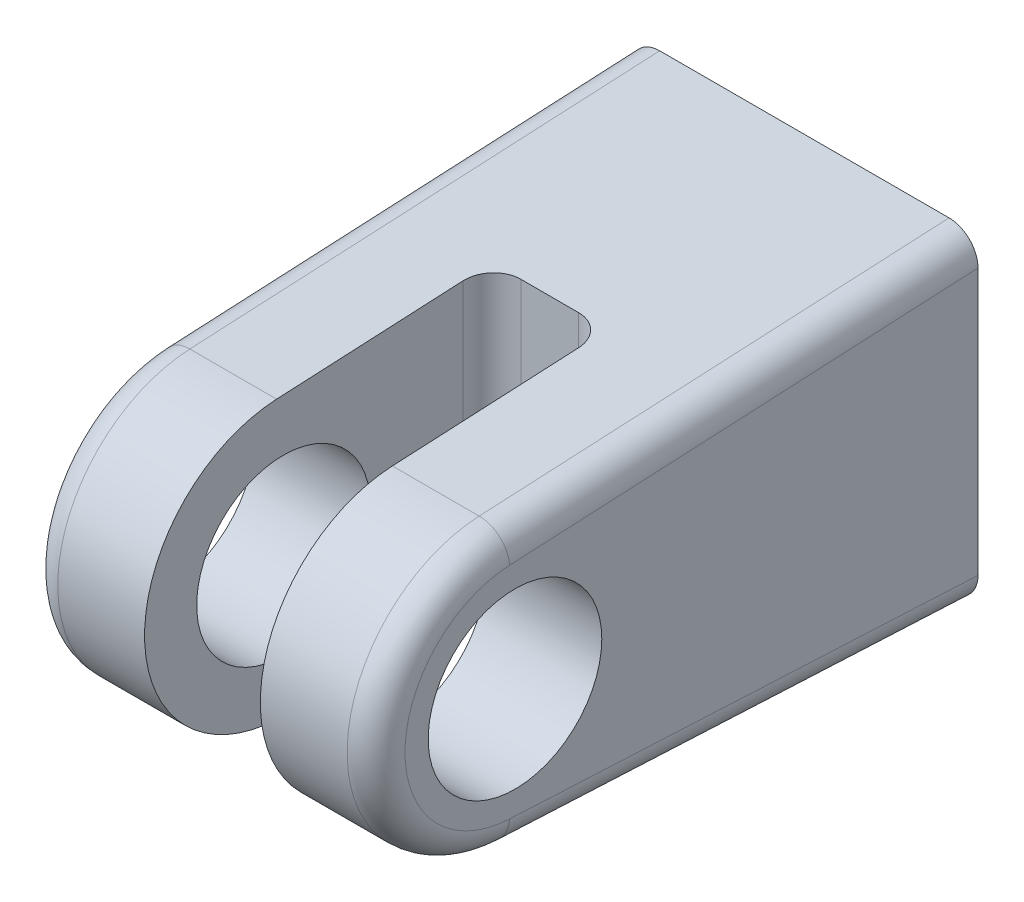
from build123d import *

# Parameters (mm, degrees)
EXTRUDE2_DEPTH          = 9.525
CUT_EXTRUDE1_DEPTH      = 36.497579143
CUT_EXTRUDE1_DEPTH_BACK = 36.497579143
SKETCH3_W               = 6.35
SKETCH3_H               = 19.05
SKETCH4_R               = 4.7625
CUT_EXTRUDE2_DEPTH      = 40.144028919
SKETCH5_R               = 6.35
CUT_EXTRUDE3_DEPTH      = 9.525
FILLET1_R               = 1.5875


with BuildPart() as part:
    # Sketch2 → Extrude2 (new, symmetric)
    with BuildSketch(Plane(origin=(0, 0, 0), x_dir=(0, 0, -1), z_dir=(1, 0, 0))):
        with BuildLine():
            Line((0, 8.89), (-25.777721364, 7.610632469))
            ThreePointArc((-25.777721364, 7.610632469), (-33.02, 0), (-25.777721364, -7.610632469))
            Line((-25.777721364, -7.610632469), (0, -8.89))
            Line((0, -8.89), (0, 8.89))
        make_face()
    extrude(amount=EXTRUDE2_DEPTH, both=True)

    # Sketch3 → Cut-Extrude1 (cut, two sides: drawn at the far end of the back side and taken through both)
    with BuildSketch(Plane(origin=(0, 0, 0), x_dir=(1, 0, 0), z_dir=(0, 1, 0)).offset(-CUT_EXTRUDE1_DEPTH_BACK)):
        with Locations((0, -23.495)):
            Rectangle(SKETCH3_W, SKETCH3_H)
    extrude(amount=CUT_EXTRUDE1_DEPTH + CUT_EXTRUDE1_DEPTH_BACK, mode=Mode.SUBTRACT)

    # Sketch4 → Cut-Extrude2 (cut, through all)
    with BuildSketch(Plane(origin=(9.525, 0, 0), x_dir=(0, 0, -1), z_dir=(1, 0, 0))):
        with Locations((-25.4, 0)):
            Circle(SKETCH4_R)
    extrude(amount=-CUT_EXTRUDE2_DEPTH, mode=Mode.SUBTRACT)

    # Sketch5 → Cut-Extrude3 (cut)
    with BuildSketch(Plane(origin=(0, 0, 0), x_dir=(-1, 0, 0), z_dir=(0, 0, -1))):
        with Locations(Location((0, 0, 0), (0, 0, 90))):
            Circle(SKETCH5_R)
    extrude(amount=-CUT_EXTRUDE3_DEPTH, mode=Mode.SUBTRACT)

    # Fillet1
    fillet1_edges = [part.edges().sort_by_distance(p)[0] for p in [
        (9.525, 0, 33.02),
        (9.525, -8.250316234, 12.888860682),
        (-3.175, 0, 13.97),
        (3.175, 0, 13.97),
        (-9.525, -8.250316234, 12.888860682),
        (-9.525, 0, 33.02),
        (-9.525, 8.250316234, 12.888860682),
        (9.525, 8.250316234, 12.888860682),
    ]]
    fillet(fillet1_edges, radius=FILLET1_R)


solid = part.part
